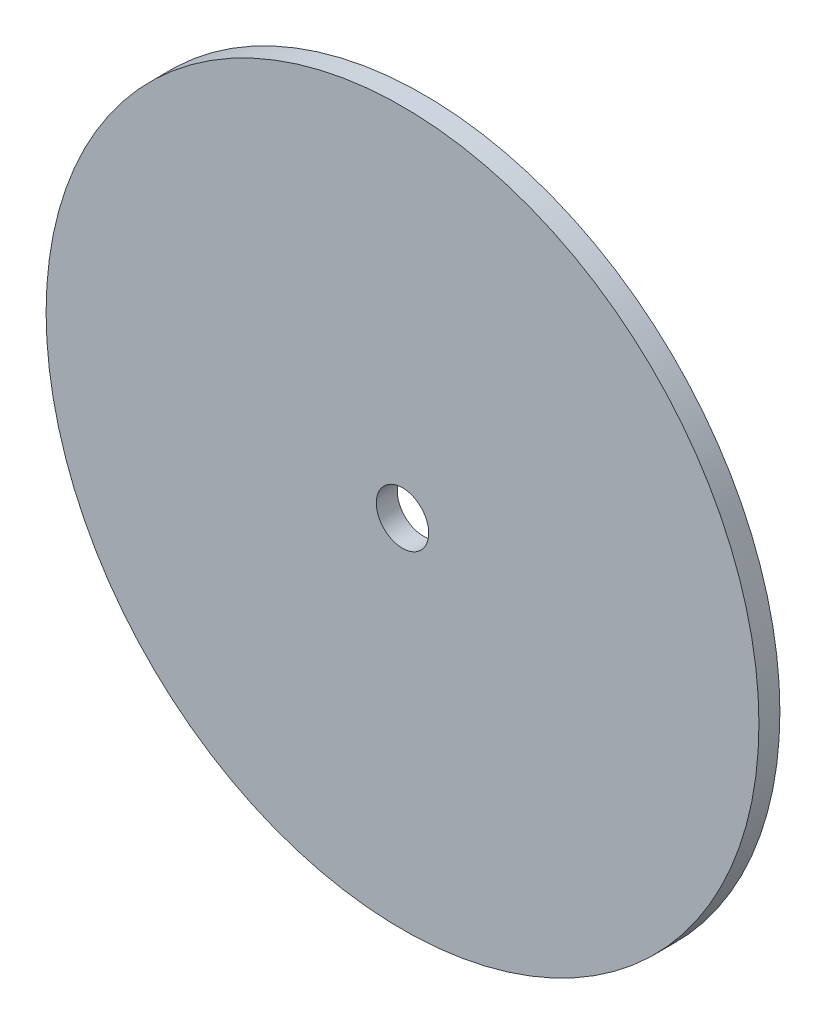
from build123d import *

# Parameters (mm, degrees)
SKETCH_1_R          = 3.4
EXTRUDE_1_DEPTH     = 0.2
SKETCH_2_W          = 0.092566565
SKETCH_2_H          = 0.1
EXTRUDE_2_DEPTH     = 0.1
SKETCH_4_R          = 0.25
CUT_EXTRUDE_1_DEPTH = 5.812483766


with BuildPart() as part:
    # Эскиз1 → Бобышка-Вытянуть1 (new body)
    with BuildSketch(Plane.XY):
        Circle(SKETCH_1_R)
    extrude(amount=EXTRUDE_1_DEPTH)

    # Эскиз2 → Вырез-Повернуть1 (revolve, cut)
    with BuildSketch(Plane(origin=(0, 0, 0), x_dir=(0, 0, -1), z_dir=(1, 0, 0)), mode=Mode.PRIVATE) as cut_revolve_1_sk:
        with Locations((-0.046283283, 1.05)):
            Rectangle(SKETCH_2_W, SKETCH_2_H)
        with Locations((-0.046283283, 1.3)):
            Rectangle(SKETCH_2_W, SKETCH_2_H)
        with Locations((-0.046283283, 1.55)):
            Rectangle(SKETCH_2_W, SKETCH_2_H)
        with Locations((-0.046283283, 1.8)):
            Rectangle(SKETCH_2_W, SKETCH_2_H)
        with Locations((-0.046283283, 2.05)):
            Rectangle(SKETCH_2_W, SKETCH_2_H)
        with Locations((-0.046283283, 2.3)):
            Rectangle(SKETCH_2_W, SKETCH_2_H)
        with Locations((-0.046283283, 2.55)):
            Rectangle(SKETCH_2_W, SKETCH_2_H)
        with Locations((-0.046283283, 2.8)):
            Rectangle(SKETCH_2_W, SKETCH_2_H)
        with Locations((-0.046283283, 3.05)):
            Rectangle(SKETCH_2_W, SKETCH_2_H)
        with Locations((-0.046283283, 3.3)):
            Rectangle(SKETCH_2_W, SKETCH_2_H)
    revolve(cut_revolve_1_sk.sketch.rotate(Axis((0, 0, 4.982498065), (0, 0, -1)), 90), axis=Axis((0, 0, 4.982498065), (0, 0, -1)), mode=Mode.SUBTRACT)

    # Эскиз3 → Бобышка-Вытянуть2 (add)
    # profile 1 of 8: a face of its own
    with BuildSketch(Plane(origin=(0, 0, 0), x_dir=(-1, 0, 0), z_dir=(0, 0, -1))):
        Polygon((-2.723217147, 0.512820513), (-2.714102564, 0.512820513), (-2.714102564, 0.166666667), (-2.656410256, 0.166666667), (-2.656410256, 0.115384615), (-2.714102564, 0.115384615), (-2.714102564, 0), (-2.758974359, 0), (-2.758974359, 0.115384615), (-2.996153846, 0.115384615), align=None)
        Polygon((-2.758974359, 0.166666667), (-2.758974359, 0.383814103), (-2.908012821, 0.166666667), align=None, mode=Mode.SUBTRACT)
    # profile 2 of 8: a face of its own
    with BuildSketch(Plane(origin=(0, 0, 0), x_dir=(-1, 0, 0), z_dir=(0, 0, -1))):
        with BuildLine():
            Line((-2.297435897, 0.5), (-2.297435897, 0.448717949))
            Line((-2.297435897, 0.448717949), (-2.467508013, 0.448717949))
            Line((-2.467508013, 0.448717949), (-2.494451122, 0.317207532))
            add(Edge.make_bspline(
                [(-2.494451122, 0.317207532), (-2.489157425, 0.318668999), (-2.478901726, 0.321500361), (-2.463764603, 0.324644043), (-2.449394288, 0.326539106), (-2.440069235, 0.326797865), (-2.435556891, 0.326923077)],
                knots=[0, 0, 0, 0, 1.100273476, 2.13160584, 3.095893838, 4, 4, 4, 4], degree=3))
            add(Edge.make_bspline(
                [(-2.435556891, 0.326923077), (-2.4299735, 0.326802229), (-2.418995157, 0.326564612), (-2.40293245, 0.324282919), (-2.38759918, 0.320691503), (-2.373027413, 0.315674285), (-2.359190191, 0.309258609), (-2.346214825, 0.301244332), (-2.333906552, 0.291882427), (-2.322486182, 0.281118854), (-2.312125566, 0.269272909), (-2.303016139, 0.25653607), (-2.295278626, 0.243032118), (-2.289055661, 0.228632032), (-2.28408647, 0.21349501), (-2.280779043, 0.197461784), (-2.278576656, 0.180683481), (-2.2783306, 0.169211399), (-2.278205128, 0.163361378)],
                knots=[0, 0, 0, 0, 1.052922333, 2.070308379, 3.05430497, 4.020497103, 4.973039431, 5.925935799, 6.892292201, 7.88610001, 8.88166317, 9.857072816, 10.836096531, 11.812156883, 12.81219415, 13.836441305, 14.89672472, 16, 16, 16, 16], degree=3))
            add(Edge.make_bspline(
                [(-2.278205128, 0.163361378), (-2.278300139, 0.159286775), (-2.278488876, 0.151192634), (-2.279448675, 0.139172034), (-2.281296634, 0.127405915), (-2.283777738, 0.115892716), (-2.286998083, 0.104654235), (-2.290896519, 0.093658302), (-2.29566738, 0.082973358), (-2.300900434, 0.072498302), (-2.306792788, 0.062469944), (-2.313332575, 0.053091517), (-2.320241931, 0.044222334), (-2.327676414, 0.035957515), (-2.335705128, 0.028351369), (-2.344230837, 0.021358758), (-2.353185512, 0.014861425), (-2.362707689, 0.009123111), (-2.372585187, 0.003842689), (-2.382960646, -0.000489245), (-2.393597889, -0.004362178), (-2.404650014, -0.007449253), (-2.416091987, -0.009868189), (-2.42794267, -0.011511132), (-2.440139908, -0.012707766), (-2.448407767, -0.012782674), (-2.452584135, -0.012820513)],
                knots=[0, 0, 0, 0, 1.056347294, 2.098418968, 3.122841568, 4.141288669, 5.149314143, 6.15115421, 7.162517403, 8.180376062, 9.185164535, 10.17417709, 11.141909838, 12.097768115, 13.052685741, 14.0056014, 14.954263652, 15.917497458, 16.885230207, 17.854509472, 18.828990115, 19.81800267, 20.826176721, 21.857883937, 22.917946725, 24, 24, 24, 24], degree=3))
            add(Edge.make_bspline(
                [(-2.452584135, -0.012820513), (-2.45756616, -0.012721822), (-2.467367708, -0.012527659), (-2.481727789, -0.010496446), (-2.495544161, -0.007587315), (-2.508705604, -0.003210705), (-2.52133007, 0.002273194), (-2.533247601, 0.009204075), (-2.544762712, 0.017058233), (-2.555407289, 0.026326855), (-2.565286734, 0.036457667), (-2.574130521, 0.047451615), (-2.582006746, 0.05912725), (-2.588789281, 0.071541272), (-2.594574713, 0.084661062), (-2.599119711, 0.098535777), (-2.602788048, 0.11309292), (-2.604339965, 0.12311485), (-2.605128205, 0.128205128)],
                knots=[0, 0, 0, 0, 1.0467383, 2.05933395, 3.04377827, 4.011590433, 4.970194871, 5.932262533, 6.905835911, 7.896367577, 8.894135286, 9.877477877, 10.858688626, 11.851381753, 12.8477658, 13.868841284, 14.917554742, 16, 16, 16, 16], degree=3))
            Line((-2.605128205, 0.128205128), (-2.56025641, 0.128205128))
            add(Edge.make_bspline(
                [(-2.56025641, 0.128205128), (-2.559152331, 0.123437064), (-2.557030228, 0.114272579), (-2.552372264, 0.101396673), (-2.546677139, 0.089922498), (-2.539905089, 0.079698272), (-2.531826514, 0.070782701), (-2.522608024, 0.062837406), (-2.512272635, 0.05566953), (-2.500787888, 0.049694849), (-2.488671733, 0.044599313), (-2.475990703, 0.041206214), (-2.463090082, 0.038820372), (-2.454364601, 0.038581549), (-2.449979968, 0.038461538)],
                knots=[0, 0, 0, 0, 1.136247022, 2.183929868, 3.172523383, 4.106158343, 5.02341133, 5.958108904, 6.928429099, 7.938127109, 8.96079061, 9.975095812, 10.982467395, 12, 12, 12, 12], degree=3))
            add(Edge.make_bspline(
                [(-2.449979968, 0.038461538), (-2.44570019, 0.038578792), (-2.437273273, 0.038809667), (-2.424871646, 0.040586668), (-2.412898378, 0.043323464), (-2.401471613, 0.047419158), (-2.390391393, 0.052396975), (-2.379937997, 0.058784843), (-2.369809015, 0.066136274), (-2.360319282, 0.07455865), (-2.351627932, 0.083840034), (-2.343948486, 0.093765376), (-2.337551784, 0.104353497), (-2.332161197, 0.115421091), (-2.328067868, 0.127089456), (-2.325147728, 0.139303909), (-2.323433006, 0.152094621), (-2.323197123, 0.160818808), (-2.323076923, 0.165264423)],
                knots=[0, 0, 0, 0, 1.027316725, 2.022795036, 3.002884548, 3.971462791, 4.93288096, 5.914575861, 6.907176829, 7.935150275, 8.956128384, 9.956726525, 10.942570165, 11.921478529, 12.907843606, 13.90538589, 14.932640048, 16, 16, 16, 16], degree=3))
            add(Edge.make_bspline(
                [(-2.323076923, 0.165264423), (-2.323170992, 0.169275245), (-2.323355117, 0.177125857), (-2.324859484, 0.188611458), (-2.327476195, 0.199479036), (-2.331108178, 0.209781069), (-2.335719536, 0.219527275), (-2.341354723, 0.228727712), (-2.348119494, 0.237261117), (-2.355846907, 0.245131482), (-2.364312342, 0.252395036), (-2.373661448, 0.258587048), (-2.38369858, 0.263796179), (-2.394302809, 0.268291607), (-2.405726365, 0.271520285), (-2.417743027, 0.273944269), (-2.430482557, 0.275346464), (-2.439192655, 0.275541019), (-2.443669872, 0.275641026)],
                knots=[0, 0, 0, 0, 1.045622112, 2.046656509, 3.013763289, 3.955457236, 4.890082067, 5.820317437, 6.762574623, 7.722996705, 8.69280354, 9.665887285, 10.63943826, 11.638615906, 12.663482002, 13.728887084, 14.832589034, 16, 16, 16, 16], degree=3))
            add(Edge.make_bspline(
                [(-2.443669872, 0.275641026), (-2.447545433, 0.275558084), (-2.455547484, 0.275386831), (-2.467822173, 0.274125903), (-2.480720991, 0.272091718), (-2.49419449, 0.269293682), (-2.508283134, 0.2656321), (-2.522957192, 0.261244314), (-2.538247515, 0.255998314), (-2.548550047, 0.252036569), (-2.553846154, 0.25)],
                knots=[0, 0, 0, 0, 0.817624296, 1.688186739, 2.600797293, 3.572016777, 4.590301741, 5.671205678, 6.80286297, 8, 8, 8, 8], degree=3))
            Line((-2.553846154, 0.25), (-2.502564103, 0.5))
            Line((-2.502564103, 0.5), (-2.297435897, 0.5))
        make_face()
    # profile 3 of 8: a face of its own
    with BuildSketch(Plane(origin=(0, 0, 0), x_dir=(-1, 0, 0), z_dir=(0, 0, -1))):
        Polygon((2.302423878, 0.5), (2.394871795, 0.5), (2.394871795, 0), (2.35, 0), (2.35, 0.448717949), (2.273076923, 0.448717949), align=None)
    # profile 4 of 8: a face of its own
    with BuildSketch(Plane(origin=(0, 0, 0), x_dir=(-1, 0, 0), z_dir=(0, 0, -1))):
        with BuildLine():
            Line((2.894871795, 0.5), (2.894871795, 0.448717949))
            Line((2.894871795, 0.448717949), (2.724799679, 0.448717949))
            Line((2.724799679, 0.448717949), (2.697856571, 0.317207532))
            add(Edge.make_bspline(
                [(2.697856571, 0.317207532), (2.703150267, 0.318668999), (2.713405966, 0.321500361), (2.728543089, 0.324644043), (2.742913404, 0.326539106), (2.752238457, 0.326797865), (2.756750801, 0.326923077)],
                knots=[0, 0, 0, 0, 1.100273476, 2.13160584, 3.095893838, 4, 4, 4, 4], degree=3))
            add(Edge.make_bspline(
                [(2.756750801, 0.326923077), (2.762334193, 0.326802229), (2.773312535, 0.326564612), (2.789375242, 0.324282919), (2.804708512, 0.320691503), (2.819280279, 0.315674285), (2.833117501, 0.309258609), (2.846092867, 0.301244332), (2.85840114, 0.291882427), (2.869821511, 0.281118854), (2.880182126, 0.269272909), (2.889291553, 0.25653607), (2.897029066, 0.243032118), (2.903252031, 0.228632032), (2.908221222, 0.21349501), (2.91152865, 0.197461784), (2.913731037, 0.180683481), (2.913977092, 0.169211399), (2.914102564, 0.163361378)],
                knots=[0, 0, 0, 0, 1.052922333, 2.070308379, 3.05430497, 4.020497103, 4.973039431, 5.925935799, 6.892292201, 7.88610001, 8.88166317, 9.857072816, 10.836096531, 11.812156883, 12.81219415, 13.836441305, 14.89672472, 16, 16, 16, 16], degree=3))
            add(Edge.make_bspline(
                [(2.914102564, 0.163361378), (2.914007553, 0.159286775), (2.913818816, 0.151192634), (2.912859018, 0.139172034), (2.911011058, 0.127405915), (2.908529955, 0.115892716), (2.905309609, 0.104654235), (2.901411173, 0.093658302), (2.896640312, 0.082973358), (2.891407258, 0.072498302), (2.885514904, 0.062469944), (2.878975118, 0.053091517), (2.872065762, 0.044222334), (2.864631278, 0.035957515), (2.856602564, 0.028351369), (2.848076855, 0.021358758), (2.839122181, 0.014861425), (2.829600003, 0.009123111), (2.819722506, 0.003842689), (2.809347046, -0.000489245), (2.798709803, -0.004362178), (2.787657678, -0.007449253), (2.776215705, -0.009868189), (2.764365023, -0.011511132), (2.752167784, -0.012707766), (2.743899925, -0.012782674), (2.739723558, -0.012820513)],
                knots=[0, 0, 0, 0, 1.056347294, 2.098418968, 3.122841568, 4.141288669, 5.149314143, 6.15115421, 7.162517403, 8.180376062, 9.185164535, 10.17417709, 11.141909838, 12.097768115, 13.052685741, 14.0056014, 14.954263652, 15.917497458, 16.885230207, 17.854509472, 18.828990115, 19.81800267, 20.826176721, 21.857883937, 22.917946725, 24, 24, 24, 24], degree=3))
            add(Edge.make_bspline(
                [(2.739723558, -0.012820513), (2.734741532, -0.012721822), (2.724939985, -0.012527659), (2.710579904, -0.010496446), (2.696763531, -0.007587315), (2.683602088, -0.003210705), (2.670977622, 0.002273194), (2.659060091, 0.009204075), (2.64754498, 0.017058233), (2.636900403, 0.026326855), (2.627020959, 0.036457667), (2.618177172, 0.047451615), (2.610300946, 0.05912725), (2.603518411, 0.071541272), (2.59773298, 0.084661062), (2.593187981, 0.098535777), (2.589519645, 0.11309292), (2.587967728, 0.12311485), (2.587179487, 0.128205128)],
                knots=[0, 0, 0, 0, 1.0467383, 2.05933395, 3.04377827, 4.011590433, 4.970194871, 5.932262533, 6.905835911, 7.896367577, 8.894135286, 9.877477877, 10.858688626, 11.851381753, 12.8477658, 13.868841284, 14.917554742, 16, 16, 16, 16], degree=3))
            Line((2.587179487, 0.128205128), (2.632051282, 0.128205128))
            add(Edge.make_bspline(
                [(2.632051282, 0.128205128), (2.633155362, 0.123437064), (2.635277464, 0.114272579), (2.639935428, 0.101396673), (2.645630553, 0.089922498), (2.652402603, 0.079698272), (2.660481179, 0.070782701), (2.669699669, 0.062837406), (2.680035058, 0.05566953), (2.691519805, 0.049694849), (2.703635959, 0.044599313), (2.716316989, 0.041206214), (2.72921761, 0.038820372), (2.737943091, 0.038581549), (2.742327724, 0.038461538)],
                knots=[0, 0, 0, 0, 1.136247022, 2.183929868, 3.172523383, 4.106158343, 5.02341133, 5.958108904, 6.928429099, 7.938127109, 8.96079061, 9.975095812, 10.982467395, 12, 12, 12, 12], degree=3))
            add(Edge.make_bspline(
                [(2.742327724, 0.038461538), (2.746607502, 0.038578792), (2.75503442, 0.038809667), (2.767436046, 0.040586668), (2.779409314, 0.043323464), (2.790836079, 0.047419158), (2.801916299, 0.052396975), (2.812369695, 0.058784843), (2.822498677, 0.066136274), (2.831988411, 0.07455865), (2.840679761, 0.083840034), (2.848359207, 0.093765376), (2.854755908, 0.104353497), (2.860146495, 0.115421091), (2.864239824, 0.127089456), (2.867159964, 0.139303909), (2.868874687, 0.152094621), (2.86911057, 0.160818808), (2.869230769, 0.165264423)],
                knots=[0, 0, 0, 0, 1.027316725, 2.022795036, 3.002884548, 3.971462791, 4.93288096, 5.914575861, 6.907176829, 7.935150275, 8.956128384, 9.956726525, 10.942570165, 11.921478529, 12.907843606, 13.90538589, 14.932640048, 16, 16, 16, 16], degree=3))
            add(Edge.make_bspline(
                [(2.869230769, 0.165264423), (2.869136701, 0.169275245), (2.868952575, 0.177125857), (2.867448208, 0.188611458), (2.864831498, 0.199479036), (2.861199515, 0.209781069), (2.856588156, 0.219527275), (2.850952969, 0.228727712), (2.844188198, 0.237261117), (2.836460785, 0.245131482), (2.827995351, 0.252395036), (2.818646245, 0.258587048), (2.808609112, 0.263796179), (2.798004884, 0.268291607), (2.786581327, 0.271520285), (2.774564665, 0.273944269), (2.761825135, 0.275346464), (2.753115037, 0.275541019), (2.748637821, 0.275641026)],
                knots=[0, 0, 0, 0, 1.045622112, 2.046656509, 3.013763289, 3.955457236, 4.890082067, 5.820317437, 6.762574623, 7.722996705, 8.69280354, 9.665887285, 10.63943826, 11.638615906, 12.663482002, 13.728887084, 14.832589034, 16, 16, 16, 16], degree=3))
            add(Edge.make_bspline(
                [(2.748637821, 0.275641026), (2.744762259, 0.275558084), (2.736760208, 0.275386831), (2.724485519, 0.274125903), (2.711586701, 0.272091718), (2.698113202, 0.269293682), (2.684024558, 0.2656321), (2.669350501, 0.261244314), (2.654060177, 0.255998314), (2.643757645, 0.252036569), (2.638461538, 0.25)],
                knots=[0, 0, 0, 0, 0.817624296, 1.688186739, 2.600797293, 3.572016777, 4.590301741, 5.671205678, 6.80286297, 8, 8, 8, 8], degree=3))
            Line((2.638461538, 0.25), (2.68974359, 0.5))
            Line((2.68974359, 0.5), (2.894871795, 0.5))
        make_face()
    # profile 5 of 8: a face of its own
    with BuildSketch(Plane(origin=(0, 0, 0), x_dir=(-1, 0, 0), z_dir=(0, 0, -1))):
        Polygon((-0.259114583, 2.9), (-0.166666667, 2.9), (-0.166666667, 2.4), (-0.211538462, 2.4), (-0.211538462, 2.848717949), (-0.288461538, 2.848717949), align=None)
    # profile 6 of 8: a face of its own
    with BuildSketch(Plane(origin=(0, 0, 0), x_dir=(-1, 0, 0), z_dir=(0, 0, -1))):
        with BuildLine():
            add(Edge.make_bspline(
                [(0.019230769, 2.649799679), (0.019277629, 2.657813592), (0.019368655, 2.673380733), (0.020381286, 2.696064253), (0.022063478, 2.717344294), (0.024368817, 2.737221875), (0.027174243, 2.755702127), (0.030919312, 2.772735664), (0.035178284, 2.788401322), (0.040114348, 2.802750186), (0.045684032, 2.815975572), (0.051746069, 2.82832203), (0.05854104, 2.839770877), (0.065680599, 2.850504847), (0.073453752, 2.860348232), (0.081639293, 2.869440041), (0.090556704, 2.877570148), (0.099902848, 2.884976763), (0.109762343, 2.891469544), (0.119854153, 2.897188507), (0.130247739, 2.902074202), (0.14097148, 2.905915693), (0.151928988, 2.909088671), (0.163158569, 2.911258521), (0.174678764, 2.912623794), (0.182454683, 2.912754318), (0.186398237, 2.912820513)],
                knots=[0, 0, 0, 0, 1.646270934, 3.197905019, 4.663502075, 6.030701355, 7.308322542, 8.50163776, 9.611534131, 10.641858119, 11.616356847, 12.558055219, 13.465016945, 14.349605745, 15.204443733, 16.039544428, 16.859896111, 17.680448484, 18.487036065, 19.28249412, 20.06191084, 20.843045899, 21.620316918, 22.403196591, 23.190181807, 24, 24, 24, 24], degree=3))
            add(Edge.make_bspline(
                [(0.186398237, 2.912820513), (0.190374734, 2.912750825), (0.198282735, 2.912612238), (0.209974218, 2.911280246), (0.221395601, 2.909070085), (0.232498192, 2.905938518), (0.24337319, 2.902053421), (0.253935534, 2.897183833), (0.264250831, 2.891515423), (0.274155158, 2.884854869), (0.283757246, 2.87742883), (0.292821241, 2.869034163), (0.301347967, 2.859755632), (0.309444439, 2.849692508), (0.316880953, 2.838651782), (0.323962872, 2.82682548), (0.330301735, 2.814006785), (0.336406688, 2.800409576), (0.341676258, 2.785657624), (0.346428578, 2.769834087), (0.350268431, 2.75275206), (0.353466899, 2.734501168), (0.355944741, 2.715014385), (0.357749404, 2.694333483), (0.358702702, 2.672444856), (0.358882231, 2.657479449), (0.358974359, 2.649799679)],
                knots=[0, 0, 0, 0, 0.810914788, 1.612654377, 2.396697861, 3.181598691, 3.963628158, 4.749916497, 5.551656086, 6.361998678, 7.18212741, 8.025565596, 8.878627764, 9.750805457, 10.657531673, 11.591944965, 12.560506719, 13.57287815, 14.630710178, 15.753379473, 16.941251878, 18.199788006, 19.531962791, 20.947069417, 22.433333509, 24, 24, 24, 24], degree=3))
            add(Edge.make_bspline(
                [(0.358974359, 2.649799679), (0.358881275, 2.642153407), (0.358699906, 2.627254957), (0.357760091, 2.605464817), (0.355908858, 2.584893668), (0.353593145, 2.565492174), (0.350385865, 2.547341085), (0.34644227, 2.530377593), (0.342063652, 2.51452844), (0.336658681, 2.499923466), (0.330742866, 2.486358935), (0.324306409, 2.473692199), (0.31741072, 2.4618113), (0.309898042, 2.450811336), (0.301890411, 2.440614385), (0.293216441, 2.431400439), (0.284120644, 2.422947486), (0.274490298, 2.415425825), (0.264431505, 2.408842281), (0.254151637, 2.402954589), (0.243468297, 2.398207061), (0.232623589, 2.394130626), (0.221462394, 2.391016276), (0.209998624, 2.388862868), (0.19829059, 2.387352604), (0.190376081, 2.387237393), (0.186398237, 2.387179487)],
                knots=[0, 0, 0, 0, 1.561518951, 3.042555995, 4.452378317, 5.7783523, 7.031515105, 8.214008947, 9.334062868, 10.386615937, 11.391082383, 12.354592575, 13.286541444, 14.194233754, 15.072674879, 15.931287219, 16.775624067, 17.606195743, 18.42308326, 19.229000347, 20.022332153, 20.807536673, 21.593273796, 22.3848459, 23.188221202, 24, 24, 24, 24], degree=3))
            add(Edge.make_bspline(
                [(0.186398237, 2.387179487), (0.182454792, 2.387246109), (0.174679089, 2.387377475), (0.163157314, 2.38873658), (0.151974108, 2.390921652), (0.141074286, 2.393981167), (0.130401926, 2.397726143), (0.120102457, 2.402605241), (0.110061359, 2.408224394), (0.100305422, 2.41462374), (0.091017971, 2.421955409), (0.082146742, 2.430064593), (0.073914596, 2.439153651), (0.066252582, 2.449079069), (0.05897057, 2.459749532), (0.052272088, 2.471310728), (0.046076251, 2.483716816), (0.040412896, 2.497047946), (0.035391658, 2.51149865), (0.030956271, 2.527234247), (0.027454249, 2.544393623), (0.024456684, 2.562838961), (0.022038915, 2.582649523), (0.020388297, 2.603836063), (0.019368109, 2.626385378), (0.019277385, 2.641852489), (0.019230769, 2.649799679)],
                knots=[0, 0, 0, 0, 0.810891512, 1.598919785, 2.382837074, 3.152667961, 3.926044502, 4.706494248, 5.493654104, 6.291793342, 7.103789334, 7.925228297, 8.761435821, 9.622817696, 10.50288917, 11.416980706, 12.369136599, 13.353924996, 14.394355917, 15.514179734, 16.714354668, 17.994756427, 19.357759367, 20.818452758, 22.365282078, 24, 24, 24, 24], degree=3))
        make_face()
        with BuildLine():
            add(Edge.make_bspline(
                [(0.064102564, 2.65), (0.064119628, 2.643321614), (0.064152746, 2.630360179), (0.065017917, 2.611525428), (0.066196522, 2.593958238), (0.067716707, 2.577636304), (0.069974271, 2.562614874), (0.072503812, 2.548790634), (0.075582111, 2.536236742), (0.079224256, 2.524867055), (0.083372699, 2.514488617), (0.087902108, 2.5048313), (0.092767925, 2.495781024), (0.098213518, 2.48741908), (0.104144241, 2.479718199), (0.110426136, 2.47254208), (0.117293648, 2.466142512), (0.126794182, 2.458467247), (0.139336536, 2.450535942), (0.155139458, 2.443629357), (0.171377808, 2.439289007), (0.182399415, 2.438737041), (0.187900641, 2.438461538)],
                knots=[0, 0, 0, 0, 1.459021318, 2.831673884, 4.118529203, 5.306027144, 6.411944654, 7.436330062, 8.375795394, 9.233974572, 10.042671642, 10.816086306, 11.563610507, 12.285937304, 12.993564865, 13.685989202, 14.367179055, 15.041617293, 16.353048772, 17.594441528, 18.799311195, 20, 20, 20, 20], degree=3))
            add(Edge.make_bspline(
                [(0.187900641, 2.438461538), (0.193437451, 2.438689793), (0.20449964, 2.43914583), (0.220661611, 2.44354565), (0.23635165, 2.450184156), (0.248647641, 2.458033799), (0.25800229, 2.465509275), (0.264704717, 2.471882796), (0.270856439, 2.479019349), (0.276691021, 2.486719248), (0.282042317, 2.495129603), (0.28690848, 2.504209971), (0.291348958, 2.513985568), (0.293878822, 2.520809816), (0.295172276, 2.524298878)],
                knots=[0, 0, 0, 0, 1.353760809, 2.704726607, 4.075137775, 5.516104923, 6.260822281, 7.007110065, 7.778089737, 8.566572457, 9.372053459, 10.217411131, 11.088608312, 12, 12, 12, 12], degree=3))
            add(Edge.make_bspline(
                [(0.295172276, 2.524298878), (0.296679671, 2.52876027), (0.29974033, 2.537818807), (0.303684869, 2.551870758), (0.306791355, 2.56661401), (0.309586121, 2.581960455), (0.311493701, 2.598023269), (0.313029103, 2.614752753), (0.313933487, 2.632161519), (0.314045594, 2.643989375), (0.314102564, 2.65)],
                knots=[0, 0, 0, 0, 0.884706709, 1.796334032, 2.740027952, 3.714592787, 4.726048262, 5.777819803, 6.87074269, 8, 8, 8, 8], degree=3))
            add(Edge.make_bspline(
                [(0.314102564, 2.65), (0.314023966, 2.656009653), (0.31387021, 2.66776582), (0.313282498, 2.684982703), (0.311764844, 2.70133524), (0.310079256, 2.716893879), (0.307593939, 2.731572493), (0.304914252, 2.745493966), (0.301314079, 2.758485826), (0.297468396, 2.770751481), (0.293066911, 2.782151574), (0.288221807, 2.792739258), (0.28304727, 2.802565647), (0.277426949, 2.811603782), (0.271427566, 2.819894145), (0.264890773, 2.827270516), (0.258075863, 2.833961511), (0.248530551, 2.841599021), (0.236034224, 2.849386406), (0.220484845, 2.856552943), (0.204303325, 2.860668414), (0.19336426, 2.861248655), (0.187900641, 2.861538462)],
                knots=[0, 0, 0, 0, 1.31362396, 2.569729283, 3.763502607, 4.902122613, 5.988968491, 7.01645872, 7.998833611, 8.933434873, 9.825090667, 10.667526885, 11.477055099, 12.250526234, 12.991942729, 13.710640831, 14.402115721, 15.076753259, 16.378508321, 17.609869233, 18.806226677, 20, 20, 20, 20], degree=3))
            add(Edge.make_bspline(
                [(0.187900641, 2.861538462), (0.182370556, 2.861248255), (0.171300313, 2.860667313), (0.154950605, 2.856568277), (0.139278555, 2.849423567), (0.126815273, 2.841573228), (0.117263303, 2.834096327), (0.110537204, 2.827612548), (0.104230608, 2.820520225), (0.098420937, 2.812748523), (0.09297961, 2.804396328), (0.087982323, 2.795397933), (0.083479847, 2.785707738), (0.079324914, 2.775333962), (0.075671658, 2.763965255), (0.072658235, 2.751426828), (0.06987437, 2.737646557), (0.067903617, 2.722543771), (0.066151652, 2.706217749), (0.065025745, 2.688606703), (0.064149851, 2.669740363), (0.064118642, 2.656711912), (0.064102564, 2.65)],
                knots=[0, 0, 0, 0, 1.207732386, 2.417664972, 3.655092373, 4.956220595, 5.625982001, 6.301752483, 6.994047911, 7.697131622, 8.419323945, 9.170223765, 9.943494443, 10.752040957, 11.610060368, 12.549350801, 13.567764191, 14.679664412, 15.874934091, 17.154273443, 18.533957287, 20, 20, 20, 20], degree=3))
        make_face(mode=Mode.SUBTRACT)
    # profile 7 of 8: a face of its own
    with BuildSketch(Plane(origin=(0, 0, 0), x_dir=(-1, 0, 0), z_dir=(0, 0, -1))):
        with BuildLine():
            Line((-0.301282051, -2.315384615), (-0.346153846, -2.315384615))
            add(Edge.make_bspline(
                [(-0.346153846, -2.315384615), (-0.344938196, -2.310351403), (-0.3425617, -2.300511886), (-0.337604903, -2.286453705), (-0.33220501, -2.273150345), (-0.325720852, -2.260850906), (-0.318648173, -2.249308206), (-0.310544927, -2.238784045), (-0.301784966, -2.229010764), (-0.292095688, -2.220337445), (-0.281934451, -2.212483483), (-0.271158076, -2.205787047), (-0.259983377, -2.200026453), (-0.24833293, -2.195280706), (-0.236172048, -2.191705631), (-0.223610673, -2.189111802), (-0.210615888, -2.187427357), (-0.201794803, -2.187262962), (-0.197315705, -2.187179487)],
                knots=[0, 0, 0, 0, 1.162005537, 2.271625781, 3.343758855, 4.383309926, 5.390229558, 6.379919256, 7.361854164, 8.333198761, 9.295911338, 10.242430842, 11.177959212, 12.116337295, 13.062827104, 14.020064771, 14.994644689, 16, 16, 16, 16], degree=3))
            add(Edge.make_bspline(
                [(-0.197315705, -2.187179487), (-0.190789599, -2.18737652), (-0.17787974, -2.187766288), (-0.158913591, -2.191325493), (-0.140624045, -2.196957655), (-0.123211296, -2.204739616), (-0.107037234, -2.214337804), (-0.09264635, -2.225761337), (-0.080233706, -2.238789809), (-0.069820223, -2.253180175), (-0.061666652, -2.268559534), (-0.055654313, -2.284388128), (-0.051994073, -2.300628409), (-0.051519707, -2.311593735), (-0.051282051, -2.31708734)],
                knots=[0, 0, 0, 0, 1.083050992, 2.142477498, 3.193116406, 4.255571735, 5.30263384, 6.308962982, 7.297363603, 8.282367274, 9.249857812, 10.179914175, 11.08814088, 12, 12, 12, 12], degree=3))
            add(Edge.make_bspline(
                [(-0.051282051, -2.31708734), (-0.051448279, -2.322374025), (-0.05177356, -2.332719247), (-0.054535518, -2.347822318), (-0.059183555, -2.362056832), (-0.065622093, -2.375482712), (-0.0739566, -2.388014832), (-0.084052699, -2.399681388), (-0.095981651, -2.410534125), (-0.105021499, -2.416751193), (-0.109675481, -2.419951923)],
                knots=[0, 0, 0, 0, 1.024540389, 2.004866551, 2.965041327, 3.920577974, 4.882998113, 5.874504559, 6.905732034, 8, 8, 8, 8], degree=3))
            add(Edge.make_bspline(
                [(-0.109675481, -2.419951923), (-0.104356659, -2.422520233), (-0.093818534, -2.427608799), (-0.079454172, -2.437588193), (-0.066414476, -2.449110528), (-0.059142516, -2.458102335), (-0.055488782, -2.462620192)],
                knots=[0, 0, 0, 0, 1.015518401, 2.012035669, 3.001164323, 4, 4, 4, 4], degree=3))
            add(Edge.make_bspline(
                [(-0.055488782, -2.462620192), (-0.053082876, -2.465914157), (-0.048310462, -2.472448145), (-0.042419672, -2.482953349), (-0.037075513, -2.49357499), (-0.032911196, -2.504597762), (-0.029686357, -2.515893907), (-0.02738121, -2.527482821), (-0.02594919, -2.539373967), (-0.025744111, -2.547418607), (-0.025641026, -2.55146234)],
                knots=[0, 0, 0, 0, 1.025084078, 2.033381695, 3.024893161, 4.013698104, 4.991890475, 5.976764909, 6.982997093, 8, 8, 8, 8], degree=3))
            add(Edge.make_bspline(
                [(-0.025641026, -2.55146234), (-0.025897385, -2.558463728), (-0.026408896, -2.572433557), (-0.030980907, -2.593072803), (-0.038068513, -2.613247875), (-0.048133789, -2.632544281), (-0.060400576, -2.650598621), (-0.07499448, -2.666752379), (-0.091749681, -2.680637894), (-0.110436202, -2.692239355), (-0.130681506, -2.701513344), (-0.152335162, -2.707950122), (-0.17508517, -2.712142407), (-0.190686213, -2.71259196), (-0.198617788, -2.712820513)],
                knots=[0, 0, 0, 0, 0.955779014, 1.907060117, 2.875433937, 3.871313158, 4.872415639, 5.851225146, 6.836215519, 7.83643374, 8.849228613, 9.86973379, 10.916971861, 12, 12, 12, 12], degree=3))
            add(Edge.make_bspline(
                [(-0.198617788, -2.712820513), (-0.203963403, -2.712696482), (-0.214481789, -2.712452432), (-0.229945146, -2.71078406), (-0.244705389, -2.707736917), (-0.258782474, -2.703636444), (-0.272188908, -2.698437624), (-0.28488378, -2.691963524), (-0.296945194, -2.684347595), (-0.308259329, -2.67549994), (-0.318824839, -2.665602606), (-0.328360943, -2.65447989), (-0.337026627, -2.642337404), (-0.344589861, -2.62903411), (-0.35139514, -2.61474193), (-0.35699242, -2.599277859), (-0.36191893, -2.582780142), (-0.364209425, -2.571283322), (-0.365384615, -2.565384615)],
                knots=[0, 0, 0, 0, 1.048658725, 2.063410685, 3.046034179, 4.001477787, 4.936774919, 5.862367409, 6.792675028, 7.730719943, 8.675894397, 9.627829632, 10.600096036, 11.597688215, 12.626045268, 13.701542398, 14.82072376, 16, 16, 16, 16], degree=3))
            Line((-0.365384615, -2.565384615), (-0.320512821, -2.565384615))
            add(Edge.make_bspline(
                [(-0.320512821, -2.565384615), (-0.319343779, -2.569234474), (-0.317069891, -2.576722785), (-0.313199277, -2.587499971), (-0.308789524, -2.597379693), (-0.304058873, -2.606434425), (-0.299090524, -2.614753339), (-0.293531249, -2.622116464), (-0.287792799, -2.628847207), (-0.283467177, -2.632639294), (-0.28135016, -2.634495192)],
                knots=[0, 0, 0, 0, 1.198163088, 2.33053128, 3.407730985, 4.417276592, 5.372219308, 6.28897303, 7.162600585, 8, 8, 8, 8], degree=3))
            add(Edge.make_bspline(
                [(-0.28135016, -2.634495192), (-0.278550649, -2.636653526), (-0.272960269, -2.64096353), (-0.263850522, -2.646463763), (-0.254269824, -2.651229624), (-0.244010584, -2.654870152), (-0.233294189, -2.657952675), (-0.221947422, -2.659969892), (-0.210070391, -2.661353916), (-0.201960711, -2.661476049), (-0.197816506, -2.661538462)],
                knots=[0, 0, 0, 0, 0.946170439, 1.889420265, 2.845303464, 3.807233317, 4.801018734, 5.828864929, 6.890507805, 8, 8, 8, 8], degree=3))
            add(Edge.make_bspline(
                [(-0.197816506, -2.661538462), (-0.193137435, -2.661450475), (-0.183987914, -2.661278425), (-0.170637219, -2.659696181), (-0.157936155, -2.657391837), (-0.146025738, -2.653832839), (-0.134749951, -2.649435574), (-0.124266858, -2.643914374), (-0.114438843, -2.637436556), (-0.105391785, -2.630073819), (-0.097256712, -2.622013606), (-0.090093925, -2.613583167), (-0.084004687, -2.604818049), (-0.079092748, -2.595669746), (-0.075214098, -2.586176141), (-0.07257364, -2.576310594), (-0.07073771, -2.566153842), (-0.070588194, -2.559249704), (-0.070512821, -2.555769231)],
                knots=[0, 0, 0, 0, 1.217147791, 2.380027433, 3.494444702, 4.572153297, 5.609568379, 6.639424714, 7.649109417, 8.668170816, 9.669597737, 10.625200337, 11.543417969, 12.441394052, 13.322311151, 14.205496177, 15.095365482, 16, 16, 16, 16], degree=3))
            add(Edge.make_bspline(
                [(-0.070512821, -2.555769231), (-0.070731435, -2.551110468), (-0.071167576, -2.541816124), (-0.074497373, -2.528142185), (-0.079974354, -2.514967412), (-0.087641856, -2.502516584), (-0.096975531, -2.49097717), (-0.107884803, -2.480681244), (-0.120460265, -2.472185517), (-0.132034532, -2.466315709), (-0.142286697, -2.462310412), (-0.151060323, -2.45964256), (-0.160882695, -2.457383466), (-0.171635031, -2.455281713), (-0.183398347, -2.453492949), (-0.196159838, -2.452001261), (-0.20992209, -2.450807684), (-0.2194494, -2.45027467), (-0.224358974, -2.45)],
                knots=[0, 0, 0, 0, 1.07054697, 2.135767047, 3.216561865, 4.33974944, 5.486079747, 6.621378074, 7.775625952, 8.963672916, 9.598146892, 10.304877434, 11.070270905, 11.915000392, 12.823868403, 13.805723172, 14.86925407, 16, 16, 16, 16], degree=3))
            Line((-0.224358974, -2.45), (-0.224358974, -2.398717949))
            add(Edge.make_bspline(
                [(-0.224358974, -2.398717949), (-0.218173094, -2.398612977), (-0.206056473, -2.398407362), (-0.188357286, -2.395920504), (-0.171432527, -2.392480414), (-0.155657278, -2.387211101), (-0.141278891, -2.381091059), (-0.128804662, -2.373969314), (-0.118409355, -2.366052922), (-0.110143488, -2.357219692), (-0.103925027, -2.347746113), (-0.099378341, -2.337872305), (-0.09669258, -2.327511725), (-0.096334057, -2.320441058), (-0.096153846, -2.316887019)],
                knots=[0, 0, 0, 0, 1.321986639, 2.589447074, 3.816329219, 5.01088745, 6.139805852, 7.153945165, 8.075214402, 8.924034688, 9.728124013, 10.488707548, 11.240355623, 12, 12, 12, 12], degree=3))
            add(Edge.make_bspline(
                [(-0.096153846, -2.316887019), (-0.096213048, -2.314275913), (-0.096330826, -2.30908124), (-0.097816152, -2.301491945), (-0.100048158, -2.294134667), (-0.10311669, -2.287040694), (-0.107223862, -2.280259226), (-0.112139003, -2.273732448), (-0.117991588, -2.267497622), (-0.124698081, -2.261686148), (-0.131899767, -2.256147686), (-0.139792592, -2.251445737), (-0.148138574, -2.247425014), (-0.156946954, -2.244109371), (-0.166246315, -2.241615187), (-0.175992966, -2.239824353), (-0.186205492, -2.238704688), (-0.193172883, -2.238543485), (-0.196714744, -2.238461538)],
                knots=[0, 0, 0, 0, 0.884392785, 1.759457502, 2.611959086, 3.489218968, 4.37281399, 5.2945488, 6.255912374, 7.266815255, 8.301784654, 9.332968512, 10.37626691, 11.440494194, 12.520033166, 13.637162961, 14.798855837, 16, 16, 16, 16], degree=3))
            add(Edge.make_bspline(
                [(-0.196714744, -2.238461538), (-0.202407839, -2.238660304), (-0.213527779, -2.239048541), (-0.229558481, -2.242448971), (-0.244461243, -2.247874412), (-0.255852481, -2.254350557), (-0.264264277, -2.260743476), (-0.270275268, -2.266326674), (-0.276178199, -2.272531364), (-0.281584724, -2.279739703), (-0.287052435, -2.28746353), (-0.292030229, -2.296095485), (-0.296867328, -2.305410398), (-0.299781978, -2.311995489), (-0.301282051, -2.315384615)],
                knots=[0, 0, 0, 0, 1.472543308, 2.876219568, 4.221790263, 5.565193594, 6.249813518, 6.953379497, 7.687249741, 8.463570142, 9.283606569, 10.136032583, 11.040678096, 12, 12, 12, 12], degree=3))
        make_face()
    # profile 8 of 8: a face of its own
    with BuildSketch(Plane(origin=(0, 0, 0), x_dir=(-1, 0, 0), z_dir=(0, 0, -1))):
        with BuildLine():
            add(Edge.make_bspline(
                [(0.019230769, -2.450200321), (0.019277629, -2.442186408), (0.019368655, -2.426619267), (0.020381286, -2.403935747), (0.022063478, -2.382655706), (0.024368817, -2.362778125), (0.027174243, -2.344297873), (0.030919312, -2.327264336), (0.035178284, -2.311598678), (0.040114348, -2.297249814), (0.045684032, -2.284024428), (0.051746069, -2.27167797), (0.05854104, -2.260229123), (0.065680599, -2.249495153), (0.073453752, -2.239651768), (0.081639293, -2.230559959), (0.090556704, -2.222429852), (0.099902848, -2.215023237), (0.109762343, -2.208530456), (0.119854153, -2.202811493), (0.130247739, -2.197925798), (0.14097148, -2.194084307), (0.151928988, -2.190911329), (0.163158569, -2.188741479), (0.174678764, -2.187376206), (0.182454683, -2.187245682), (0.186398237, -2.187179487)],
                knots=[0, 0, 0, 0, 1.646270934, 3.197905019, 4.663502075, 6.030701355, 7.308322542, 8.50163776, 9.611534131, 10.641858119, 11.616356847, 12.558055219, 13.465016945, 14.349605745, 15.204443733, 16.039544428, 16.859896111, 17.680448484, 18.487036065, 19.28249412, 20.06191084, 20.843045899, 21.620316918, 22.403196591, 23.190181807, 24, 24, 24, 24], degree=3))
            add(Edge.make_bspline(
                [(0.186398237, -2.187179487), (0.190374734, -2.187249175), (0.198282735, -2.187387762), (0.209974218, -2.188719754), (0.221395601, -2.190929915), (0.232498192, -2.194061482), (0.24337319, -2.197946579), (0.253935534, -2.202816167), (0.264250831, -2.208484577), (0.274155158, -2.215145131), (0.283757246, -2.22257117), (0.292821241, -2.230965837), (0.301347967, -2.240244368), (0.309444439, -2.250307492), (0.316880953, -2.261348218), (0.323962872, -2.27317452), (0.330301735, -2.285993215), (0.336406688, -2.299590424), (0.341676258, -2.314342376), (0.346428578, -2.330165913), (0.350268431, -2.34724794), (0.353466899, -2.365498832), (0.355944741, -2.384985615), (0.357749404, -2.405666517), (0.358702702, -2.427555144), (0.358882231, -2.442520551), (0.358974359, -2.450200321)],
                knots=[0, 0, 0, 0, 0.810914788, 1.612654377, 2.396697861, 3.181598691, 3.963628158, 4.749916497, 5.551656086, 6.361998678, 7.18212741, 8.025565596, 8.878627764, 9.750805457, 10.657531673, 11.591944965, 12.560506719, 13.57287815, 14.630710178, 15.753379473, 16.941251878, 18.199788006, 19.531962791, 20.947069417, 22.433333509, 24, 24, 24, 24], degree=3))
            add(Edge.make_bspline(
                [(0.358974359, -2.450200321), (0.358881275, -2.457846593), (0.358699906, -2.472745043), (0.357760091, -2.494535183), (0.355908858, -2.515106332), (0.353593145, -2.534507826), (0.350385865, -2.552658915), (0.34644227, -2.569622407), (0.342063652, -2.58547156), (0.336658681, -2.600076534), (0.330742866, -2.613641065), (0.324306409, -2.626307801), (0.31741072, -2.6381887), (0.309898042, -2.649188664), (0.301890411, -2.659385615), (0.293216441, -2.668599561), (0.284120644, -2.677052514), (0.274490298, -2.684574175), (0.264431505, -2.691157719), (0.254151637, -2.697045411), (0.243468297, -2.701792939), (0.232623589, -2.705869374), (0.221462394, -2.708983724), (0.209998624, -2.711137132), (0.19829059, -2.712647396), (0.190376081, -2.712762607), (0.186398237, -2.712820513)],
                knots=[0, 0, 0, 0, 1.561518951, 3.042555995, 4.452378317, 5.7783523, 7.031515105, 8.214008947, 9.334062868, 10.386615937, 11.391082383, 12.354592575, 13.286541444, 14.194233754, 15.072674879, 15.931287219, 16.775624067, 17.606195743, 18.42308326, 19.229000347, 20.022332153, 20.807536673, 21.593273796, 22.3848459, 23.188221202, 24, 24, 24, 24], degree=3))
            add(Edge.make_bspline(
                [(0.186398237, -2.712820513), (0.182454792, -2.712753891), (0.174679089, -2.712622525), (0.163157314, -2.71126342), (0.151974108, -2.709078348), (0.141074286, -2.706018833), (0.130401926, -2.702273857), (0.120102457, -2.697394759), (0.110061359, -2.691775606), (0.100305422, -2.68537626), (0.091017971, -2.678044591), (0.082146742, -2.669935407), (0.073914596, -2.660846349), (0.066252582, -2.650920931), (0.05897057, -2.640250468), (0.052272088, -2.628689272), (0.046076251, -2.616283184), (0.040412896, -2.602952054), (0.035391658, -2.58850135), (0.030956271, -2.572765753), (0.027454249, -2.555606377), (0.024456684, -2.537161039), (0.022038915, -2.517350477), (0.020388297, -2.496163937), (0.019368109, -2.473614622), (0.019277385, -2.458147511), (0.019230769, -2.450200321)],
                knots=[0, 0, 0, 0, 0.810891512, 1.598919785, 2.382837074, 3.152667961, 3.926044502, 4.706494248, 5.493654104, 6.291793342, 7.103789334, 7.925228297, 8.761435821, 9.622817696, 10.50288917, 11.416980706, 12.369136599, 13.353924996, 14.394355917, 15.514179734, 16.714354668, 17.994756427, 19.357759367, 20.818452758, 22.365282078, 24, 24, 24, 24], degree=3))
        make_face()
        with BuildLine():
            add(Edge.make_bspline(
                [(0.064102564, -2.45), (0.064119628, -2.456678386), (0.064152746, -2.469639821), (0.065017917, -2.488474572), (0.066196522, -2.506041762), (0.067716707, -2.522363696), (0.069974271, -2.537385126), (0.072503812, -2.551209366), (0.075582111, -2.563763258), (0.079224256, -2.575132945), (0.083372699, -2.585511383), (0.087902108, -2.5951687), (0.092767925, -2.604218976), (0.098213518, -2.61258092), (0.104144241, -2.620281801), (0.110426136, -2.62745792), (0.117293648, -2.633857488), (0.126794182, -2.641532753), (0.139336536, -2.649464058), (0.155139458, -2.656370643), (0.171377808, -2.660710993), (0.182399415, -2.661262959), (0.187900641, -2.661538462)],
                knots=[0, 0, 0, 0, 1.459021318, 2.831673884, 4.118529203, 5.306027144, 6.411944654, 7.436330062, 8.375795394, 9.233974572, 10.042671642, 10.816086306, 11.563610507, 12.285937304, 12.993564865, 13.685989202, 14.367179055, 15.041617293, 16.353048772, 17.594441528, 18.799311195, 20, 20, 20, 20], degree=3))
            add(Edge.make_bspline(
                [(0.187900641, -2.661538462), (0.193437451, -2.661310207), (0.20449964, -2.66085417), (0.220661611, -2.65645435), (0.23635165, -2.649815844), (0.248647641, -2.641966201), (0.25800229, -2.634490725), (0.264704717, -2.628117204), (0.270856439, -2.620980651), (0.276691021, -2.613280752), (0.282042317, -2.604870397), (0.28690848, -2.595790029), (0.291348958, -2.586014432), (0.293878822, -2.579190184), (0.295172276, -2.575701122)],
                knots=[0, 0, 0, 0, 1.353760809, 2.704726607, 4.075137775, 5.516104923, 6.260822281, 7.007110065, 7.778089737, 8.566572457, 9.372053459, 10.217411131, 11.088608312, 12, 12, 12, 12], degree=3))
            add(Edge.make_bspline(
                [(0.295172276, -2.575701122), (0.296679671, -2.57123973), (0.29974033, -2.562181193), (0.303684869, -2.548129242), (0.306791355, -2.53338599), (0.309586121, -2.518039545), (0.311493701, -2.501976731), (0.313029103, -2.485247247), (0.313933487, -2.467838481), (0.314045594, -2.456010625), (0.314102564, -2.45)],
                knots=[0, 0, 0, 0, 0.884706709, 1.796334032, 2.740027952, 3.714592787, 4.726048262, 5.777819803, 6.87074269, 8, 8, 8, 8], degree=3))
            add(Edge.make_bspline(
                [(0.314102564, -2.45), (0.314023966, -2.443990347), (0.31387021, -2.43223418), (0.313282498, -2.415017297), (0.311764844, -2.39866476), (0.310079256, -2.383106121), (0.307593939, -2.368427507), (0.304914252, -2.354506034), (0.301314079, -2.341514174), (0.297468396, -2.329248519), (0.293066911, -2.317848426), (0.288221807, -2.307260742), (0.28304727, -2.297434353), (0.277426949, -2.288396218), (0.271427566, -2.280105855), (0.264890773, -2.272729484), (0.258075863, -2.266038489), (0.248530551, -2.258400979), (0.236034224, -2.250613594), (0.220484845, -2.243447057), (0.204303325, -2.239331586), (0.19336426, -2.238751345), (0.187900641, -2.238461538)],
                knots=[0, 0, 0, 0, 1.31362396, 2.569729283, 3.763502607, 4.902122613, 5.988968491, 7.01645872, 7.998833611, 8.933434873, 9.825090667, 10.667526885, 11.477055099, 12.250526234, 12.991942729, 13.710640831, 14.402115721, 15.076753259, 16.378508321, 17.609869233, 18.806226677, 20, 20, 20, 20], degree=3))
            add(Edge.make_bspline(
                [(0.187900641, -2.238461538), (0.182370556, -2.238751745), (0.171300313, -2.239332687), (0.154950605, -2.243431723), (0.139278555, -2.250576433), (0.126815273, -2.258426772), (0.117263303, -2.265903673), (0.110537204, -2.272387452), (0.104230608, -2.279479775), (0.098420937, -2.287251477), (0.09297961, -2.295603672), (0.087982323, -2.304602067), (0.083479847, -2.314292262), (0.079324914, -2.324666038), (0.075671658, -2.336034745), (0.072658235, -2.348573172), (0.06987437, -2.362353443), (0.067903617, -2.377456229), (0.066151652, -2.393782251), (0.065025745, -2.411393297), (0.064149851, -2.430259637), (0.064118642, -2.443288088), (0.064102564, -2.45)],
                knots=[0, 0, 0, 0, 1.207732386, 2.417664972, 3.655092373, 4.956220595, 5.625982001, 6.301752483, 6.994047911, 7.697131622, 8.419323945, 9.170223765, 9.943494443, 10.752040957, 11.610060368, 12.549350801, 13.567764191, 14.679664412, 15.874934091, 17.154273443, 18.533957287, 20, 20, 20, 20], degree=3))
        make_face(mode=Mode.SUBTRACT)
    extrude(amount=EXTRUDE_2_DEPTH)

    # Эскиз4 → Вырез-Вытянуть1 (cut, through all)
    with BuildSketch(Plane(origin=(0, 0, 0), x_dir=(-1, 0, 0), z_dir=(0, 0, -1))):
        Circle(SKETCH_4_R)
    extrude(amount=-CUT_EXTRUDE_1_DEPTH, mode=Mode.SUBTRACT)


solid = part.part
